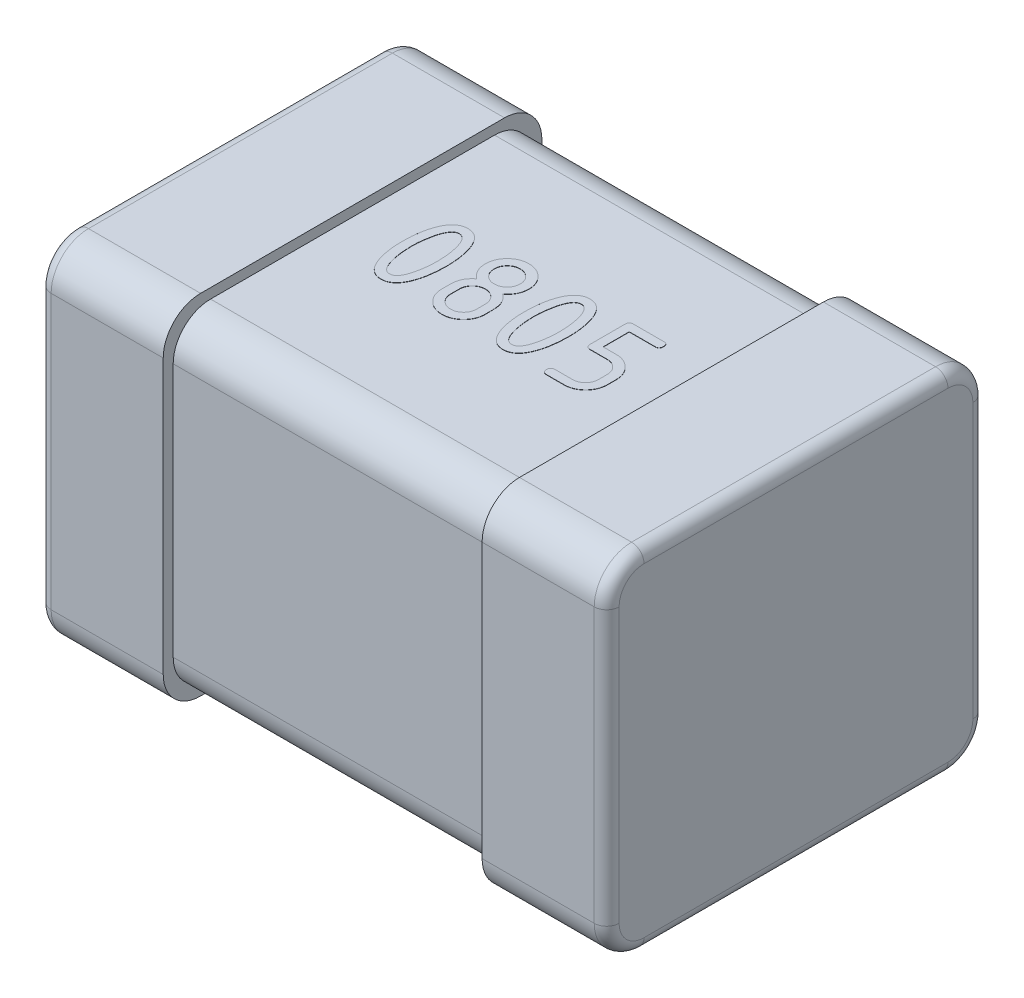
from build123d import *

# Parameters (mm, degrees)
SKETCH1_W               = 2.28
SKETCH1_H               = 1.52
BOSS_EXTRUDE1_DEPTH     = 0.7
CUT_EXTRUDE1_DEPTH      = 0.64
CUT_EXTRUDE1_DEPTH_BACK = 0.64
SKETCH3_OUTSIDE_W       = 4.136
SKETCH3_OUTSIDE_H       = 4.016
SKETCH3_OUTSIDE_W_2     = 1.44
SKETCH3_OUTSIDE_H_2     = 1.32
FILLET1_R               = 0.15
FILLET2_R               = 0.15
FILLET3_R               = 0.05
BOSS_EXTRUDE2_DEPTH     = 0.001


with BuildPart() as part:
    # Sketch1 → Boss-Extrude1 (new, symmetric)
    with BuildSketch(Plane(origin=(0, 0, 0), x_dir=(1, 0, 0), z_dir=(0, 1, 0))):
        Rectangle(SKETCH1_W, SKETCH1_H)
    extrude(amount=BOSS_EXTRUDE1_DEPTH, both=True)

    # Sketch3 outside → Cut-Extrude1 (cut, two sides: drawn at the far end of the back side and taken through both)
    with BuildSketch(Plane(origin=(0, 0, 0), x_dir=(0, 0, -1), z_dir=(1, 0, 0)).offset(-CUT_EXTRUDE1_DEPTH_BACK)):
        Rectangle(SKETCH3_OUTSIDE_W, SKETCH3_OUTSIDE_H)
        Rectangle(SKETCH3_OUTSIDE_W_2, SKETCH3_OUTSIDE_H_2, mode=Mode.SUBTRACT)
    extrude(amount=CUT_EXTRUDE1_DEPTH + CUT_EXTRUDE1_DEPTH_BACK, mode=Mode.SUBTRACT)

    # Fillet1
    fillet1_edges = [part.edges().sort_by_distance(p)[0] for p in [
        (0, -0.66, 0.72),
        (0, -0.66, -0.72),
        (0, 0.66, -0.72),
        (0, 0.66, 0.72),
    ]]
    fillet(fillet1_edges, radius=FILLET1_R)

    # Fillet2
    fillet2_edges = [part.edges().sort_by_distance(p)[0] for p in [
        (-0.89, 0.7, 0.76),
        (0.89, -0.7, 0.76),
        (-0.89, -0.7, -0.76),
        (-0.89, 0.7, -0.76),
        (0.89, 0.7, 0.76),
        (-0.89, -0.7, 0.76),
        (0.89, -0.7, -0.76),
        (0.89, 0.7, -0.76),
    ]]
    fillet(fillet2_edges, radius=FILLET2_R)

    # Fillet3
    fillet3_edges = [part.edges().sort_by_distance(p)[0] for p in [
        (-1.14, 0, 0.76),
        (-1.14, -0.7, 0),
        (-1.14, 0.7, 0),
        (-1.14, 0, -0.76),
        (-1.14, 0.656066017, -0.716066017),
        (-1.14, -0.656066017, -0.716066017),
        (-1.14, 0.656066017, 0.716066017),
        (-1.14, -0.656066017, 0.716066017),
        (1.14, 0.7, 0),
        (1.14, -0.7, 0),
        (1.14, 0, -0.76),
        (1.14, 0, 0.76),
        (1.14, -0.656066017, -0.716066017),
        (1.14, 0.656066017, -0.716066017),
        (1.14, -0.656066017, 0.716066017),
        (1.14, 0.656066017, 0.716066017),
    ]]
    fillet(fillet3_edges, radius=FILLET3_R)

    # Sketch4 → Boss-Extrude2 (add)
    # profile 1 of 4: a face of its own
    with BuildSketch(Plane(origin=(0, 0.66, 0), x_dir=(1, 0, 0), z_dir=(0, 1, 0))):
        with BuildLine():
            add(Edge.make_bspline(
                [(-0.28, 0.015785935), (-0.280046262, 0.010655154), (-0.280137186, 0.000570931), (-0.28081567, -0.014287297), (-0.282122841, -0.028608792), (-0.283681174, -0.042411166), (-0.28590852, -0.055670388), (-0.288563008, -0.068414673), (-0.291623884, -0.080662211), (-0.294151144, -0.088549105), (-0.295390625, -0.09241719)],
                knots=[0, 0, 0, 0, 1.121884543, 2.204992808, 3.251003932, 4.265943523, 5.241379217, 6.189508073, 7.112053941, 8, 8, 8, 8], degree=3))
            add(Edge.make_bspline(
                [(-0.295390625, -0.09241719), (-0.297279595, -0.097674185), (-0.30089121, -0.107725298), (-0.307891066, -0.121359317), (-0.315588453, -0.133031829), (-0.324268521, -0.142575695), (-0.333803325, -0.150071106), (-0.344261611, -0.155437314), (-0.355615923, -0.158674607), (-0.363494625, -0.159032248), (-0.3675, -0.159214065)],
                knots=[0, 0, 0, 0, 1.267950427, 2.424258098, 3.472816797, 4.435939713, 5.342465326, 6.213003319, 7.091526505, 8, 8, 8, 8], degree=3))
            add(Edge.make_bspline(
                [(-0.3675, -0.159214065), (-0.371505069, -0.15903186), (-0.379383168, -0.158673457), (-0.390741875, -0.15544172), (-0.401169271, -0.150061785), (-0.410759823, -0.142663403), (-0.419383348, -0.133113626), (-0.427113498, -0.121523157), (-0.434124701, -0.107940889), (-0.43772318, -0.097909606), (-0.439609375, -0.092651565)],
                knots=[0, 0, 0, 0, 0.910041478, 1.790080955, 2.662121456, 3.566587881, 4.531373102, 5.576831042, 6.729861149, 8, 8, 8, 8], degree=3))
            add(Edge.make_bspline(
                [(-0.439609375, -0.092651565), (-0.44084894, -0.088783494), (-0.443376371, -0.080896627), (-0.446435911, -0.068648874), (-0.449100955, -0.05588029), (-0.451310173, -0.042592052), (-0.452883712, -0.028739686), (-0.454179827, -0.014391032), (-0.454864933, 0.000518743), (-0.454954378, 0.010629079), (-0.455, 0.015785935)],
                knots=[0, 0, 0, 0, 0.886064917, 1.806656342, 2.752776557, 3.731751904, 4.744541313, 5.793997073, 6.874810739, 8, 8, 8, 8], degree=3))
            add(Edge.make_bspline(
                [(-0.455, 0.015785935), (-0.454954378, 0.020942792), (-0.454864933, 0.031053127), (-0.454179827, 0.045962903), (-0.452883712, 0.060311556), (-0.451310173, 0.074163922), (-0.449100955, 0.08745216), (-0.446435911, 0.100220744), (-0.443376371, 0.112468497), (-0.44084894, 0.120355364), (-0.439609375, 0.124223435)],
                knots=[0, 0, 0, 0, 1.125189261, 2.206002927, 3.255458687, 4.268248096, 5.247223443, 6.193343658, 7.113935083, 8, 8, 8, 8], degree=3))
            add(Edge.make_bspline(
                [(-0.439609375, 0.124223435), (-0.43772318, 0.129481476), (-0.434124701, 0.139512759), (-0.427113498, 0.153095028), (-0.419383348, 0.164685496), (-0.410759823, 0.174235273), (-0.401169271, 0.181633655), (-0.390741875, 0.18701359), (-0.379383168, 0.190245328), (-0.371505069, 0.19060373), (-0.3675, 0.190785935)],
                knots=[0, 0, 0, 0, 1.270138851, 2.423168958, 3.468626898, 4.433412119, 5.337878544, 6.209919045, 7.089958522, 8, 8, 8, 8], degree=3))
            add(Edge.make_bspline(
                [(-0.3675, 0.190785935), (-0.363494625, 0.190604118), (-0.355615923, 0.190246477), (-0.344261611, 0.187009184), (-0.333803325, 0.181642976), (-0.324268521, 0.174147565), (-0.315588453, 0.164603699), (-0.307891066, 0.152931187), (-0.30089121, 0.139297168), (-0.297279595, 0.129246055), (-0.295390625, 0.12398906)],
                knots=[0, 0, 0, 0, 0.908473495, 1.786996681, 2.657534674, 3.564060287, 4.527183203, 5.575741902, 6.732049573, 8, 8, 8, 8], degree=3))
            add(Edge.make_bspline(
                [(-0.295390625, 0.12398906), (-0.294151144, 0.120120975), (-0.291623884, 0.112234081), (-0.288563008, 0.099986544), (-0.28590852, 0.087242258), (-0.283681174, 0.073983037), (-0.282122841, 0.060180663), (-0.28081567, 0.045859168), (-0.280137186, 0.031000939), (-0.280046262, 0.020916716), (-0.28, 0.015785935)],
                knots=[0, 0, 0, 0, 0.887946059, 1.810491927, 2.758620783, 3.734056477, 4.748996068, 5.795007192, 6.878115457, 8, 8, 8, 8], degree=3))
        make_face()
        with BuildLine():
            add(Edge.make_bspline(
                [(-0.315, 0.015785935), (-0.315086915, 0.02292592), (-0.315258809, 0.037046971), (-0.317170671, 0.057878257), (-0.319935666, 0.078122758), (-0.322853106, 0.091245127), (-0.324296875, 0.09773906)],
                knots=[0, 0, 0, 0, 1.036187695, 2.04931225, 3.03465332, 4, 4, 4, 4], degree=3))
            add(Edge.make_bspline(
                [(-0.324296875, 0.09773906), (-0.32547645, 0.102291239), (-0.327704022, 0.110887816), (-0.331921362, 0.122732827), (-0.336525222, 0.132821549), (-0.341715569, 0.141081452), (-0.347308174, 0.147688189), (-0.353581898, 0.152350812), (-0.360395422, 0.155221405), (-0.365130273, 0.155597636), (-0.3675, 0.155785935)],
                knots=[0, 0, 0, 0, 1.452784662, 2.743516012, 3.881318599, 4.872714509, 5.751019032, 6.539832634, 7.269206463, 8, 8, 8, 8], degree=3))
            add(Edge.make_bspline(
                [(-0.3675, 0.155785935), (-0.36987367, 0.155607815), (-0.374602219, 0.155252986), (-0.381324249, 0.152247913), (-0.387542115, 0.147612745), (-0.393067788, 0.140963594), (-0.398219201, 0.13267967), (-0.402864053, 0.12255815), (-0.407056582, 0.110650448), (-0.409287629, 0.102004005), (-0.41046875, 0.09742656)],
                knots=[0, 0, 0, 0, 0.73024413, 1.454707756, 2.2364598, 3.108818404, 4.106268943, 5.243216136, 6.540552912, 8, 8, 8, 8], degree=3))
            add(Edge.make_bspline(
                [(-0.41046875, 0.09742656), (-0.411933245, 0.090827865), (-0.414869644, 0.077597087), (-0.417767383, 0.05733777), (-0.419633257, 0.036706645), (-0.419877125, 0.022795265), (-0.42, 0.015785935)],
                knots=[0, 0, 0, 0, 0.984359877, 1.973700231, 2.979037069, 4, 4, 4, 4], degree=3))
            add(Edge.make_bspline(
                [(-0.42, 0.015785935), (-0.419913139, 0.008671989), (-0.419741356, -0.005397071), (-0.417826553, -0.026176238), (-0.415048304, -0.04644329), (-0.412145296, -0.059620801), (-0.410703125, -0.06616719)],
                knots=[0, 0, 0, 0, 1.032445105, 2.041839016, 3.027215061, 4, 4, 4, 4], degree=3))
            add(Edge.make_bspline(
                [(-0.410703125, -0.06616719), (-0.40952355, -0.070719369), (-0.407295978, -0.079315946), (-0.403078638, -0.091160957), (-0.398474778, -0.101249679), (-0.393284431, -0.109509582), (-0.387691826, -0.116116319), (-0.381418102, -0.120778942), (-0.374604578, -0.123649535), (-0.369869727, -0.124025766), (-0.3675, -0.124214065)],
                knots=[0, 0, 0, 0, 1.452784662, 2.743516012, 3.881318599, 4.872714509, 5.751019032, 6.539832634, 7.269206463, 8, 8, 8, 8], degree=3))
            add(Edge.make_bspline(
                [(-0.3675, -0.124214065), (-0.365130273, -0.124025766), (-0.360395422, -0.123649535), (-0.353581898, -0.120778942), (-0.347308174, -0.116116319), (-0.341715569, -0.109509582), (-0.336525222, -0.101249679), (-0.331921362, -0.091160957), (-0.327704022, -0.079315946), (-0.32547645, -0.070719369), (-0.324296875, -0.06616719)],
                knots=[0, 0, 0, 0, 0.730793537, 1.460167366, 2.248980968, 3.127285491, 4.118681401, 5.256483988, 6.547215338, 8, 8, 8, 8], degree=3))
            add(Edge.make_bspline(
                [(-0.324296875, -0.06616719), (-0.322854704, -0.059620801), (-0.319951696, -0.04644329), (-0.317173447, -0.026176238), (-0.315258644, -0.005397071), (-0.315086861, 0.008671989), (-0.315, 0.015785935)],
                knots=[0, 0, 0, 0, 0.972784939, 1.958160984, 2.967554895, 4, 4, 4, 4], degree=3))
        make_face(mode=Mode.SUBTRACT)
    # profile 2 of 4: a face of its own
    with BuildSketch(Plane(origin=(0, 0.66, 0), x_dir=(1, 0, 0), z_dir=(0, 1, 0))):
        with BuildLine():
            add(Edge.make_bspline(
                [(-0.1225, -0.159214065), (-0.125472136, -0.15913874), (-0.131335884, -0.158990131), (-0.139958556, -0.157821305), (-0.14823998, -0.155743262), (-0.15620746, -0.152952851), (-0.16383255, -0.149344606), (-0.171067876, -0.144889506), (-0.17806404, -0.139763055), (-0.184527458, -0.133741522), (-0.19054899, -0.127278105), (-0.195675442, -0.120281941), (-0.200130541, -0.113046615), (-0.203738786, -0.105421525), (-0.206529197, -0.097454045), (-0.20860724, -0.089172621), (-0.209776066, -0.080549949), (-0.209924675, -0.074686201), (-0.21, -0.071714065)],
                knots=[0, 0, 0, 0, 1.035857351, 2.043650141, 3.025599911, 4.00750772, 4.982044535, 5.959747152, 6.965575591, 8, 9.034424409, 10.040252848, 11.017955465, 11.99249228, 12.974400089, 13.956349859, 14.964142649, 16, 16, 16, 16], degree=3))
            Line((-0.21, -0.071714065), (-0.21, -0.036714065))
            add(Edge.make_bspline(
                [(-0.21, -0.036714065), (-0.209898937, -0.033166151), (-0.209700879, -0.026213143), (-0.208027638, -0.016059659), (-0.205249161, -0.006461736), (-0.201559218, 0.002683173), (-0.196508297, 0.011158298), (-0.190565532, 0.019215145), (-0.183412306, 0.026656129), (-0.177991947, 0.031050386), (-0.175234375, 0.033285935)],
                knots=[0, 0, 0, 0, 1.048185513, 2.054176508, 3.031096563, 3.99737623, 4.959754699, 5.938825261, 6.951390663, 8, 8, 8, 8], degree=3))
            add(Edge.make_bspline(
                [(-0.175234375, 0.033285935), (-0.177992304, 0.035521289), (-0.183413363, 0.03991516), (-0.190561527, 0.047358924), (-0.196536105, 0.055423811), (-0.20151604, 0.063936527), (-0.205270522, 0.073050099), (-0.208023572, 0.08263337), (-0.209701958, 0.092784524), (-0.209899301, 0.099737856), (-0.21, 0.103285935)],
                knots=[0, 0, 0, 0, 1.048668505, 2.061291041, 3.040416849, 4.009506313, 4.968732406, 5.945707584, 6.951755342, 8, 8, 8, 8], degree=3))
            add(Edge.make_bspline(
                [(-0.21, 0.103285935), (-0.209924568, 0.106258016), (-0.209775748, 0.112121654), (-0.208608457, 0.120745123), (-0.206524757, 0.129023611), (-0.203763045, 0.136979726), (-0.200081371, 0.144564926), (-0.19572901, 0.151837549), (-0.19051581, 0.158773178), (-0.18453626, 0.165243948), (-0.178036844, 0.171247171), (-0.171094464, 0.176470766), (-0.163829052, 0.180911853), (-0.156208404, 0.184525969), (-0.148239726, 0.187314797), (-0.139958626, 0.189393267), (-0.131335866, 0.190561977), (-0.12547213, 0.190710602), (-0.1225, 0.190785935)],
                knots=[0, 0, 0, 0, 1.036004481, 2.043940414, 3.026029657, 4.008076933, 4.974556657, 5.960164742, 6.958858073, 7.993429408, 9.028000743, 10.039406346, 11.017247833, 11.991923067, 12.973970343, 13.956059586, 14.963995519, 16, 16, 16, 16], degree=3))
            add(Edge.make_bspline(
                [(-0.1225, 0.190785935), (-0.119527926, 0.190710495), (-0.113664299, 0.190561659), (-0.105040742, 0.189394484), (-0.09676258, 0.187310358), (-0.088805259, 0.184550221), (-0.081224519, 0.180862721), (-0.07392139, 0.176524512), (-0.067040175, 0.171214082), (-0.060533143, 0.165252792), (-0.054571853, 0.15874576), (-0.049261423, 0.151864545), (-0.044923215, 0.144561416), (-0.041235714, 0.136980676), (-0.038475577, 0.129023356), (-0.036391451, 0.120745194), (-0.035224276, 0.112121636), (-0.03507544, 0.10625801), (-0.035, 0.103285935)],
                knots=[0, 0, 0, 0, 1.03614655, 2.044220704, 3.026444622, 4.008626568, 4.975238828, 5.960982072, 6.965286792, 8, 9.034713208, 10.039017928, 11.024761172, 11.991373432, 12.973555378, 13.955779296, 14.96385345, 16, 16, 16, 16], degree=3))
            add(Edge.make_bspline(
                [(-0.035, 0.103285935), (-0.035090583, 0.099735923), (-0.035268212, 0.092774519), (-0.037091044, 0.082646492), (-0.039765807, 0.07301273), (-0.043740982, 0.063936284), (-0.048846127, 0.055389488), (-0.055080754, 0.04738338), (-0.062374638, 0.039885117), (-0.067940807, 0.03551568), (-0.07078125, 0.033285935)],
                knots=[0, 0, 0, 0, 1.040763239, 2.040887161, 3.010889577, 3.969260993, 4.939173083, 5.925181052, 6.941209693, 8, 8, 8, 8], degree=3))
            add(Edge.make_bspline(
                [(-0.07078125, 0.033285935), (-0.068698536, 0.031676366), (-0.064617748, 0.028522641), (-0.059027911, 0.023340946), (-0.054114549, 0.017835114), (-0.049679318, 0.012136831), (-0.045928082, 0.006066789), (-0.04272141, -0.000249383), (-0.040098311, -0.006834805), (-0.038887542, -0.011387453), (-0.03828125, -0.01366719)],
                knots=[0, 0, 0, 0, 1.082926845, 2.121843868, 3.131151544, 4.117203343, 5.089648923, 6.062625877, 7.029860409, 8, 8, 8, 8], degree=3))
            add(Edge.make_bspline(
                [(-0.03828125, -0.01366719), (-0.038000116, -0.014991942), (-0.037375451, -0.01793547), (-0.03685005, -0.02288418), (-0.036166483, -0.028732632), (-0.035733788, -0.035537581), (-0.035445872, -0.04324879), (-0.035209684, -0.051895286), (-0.035057498, -0.061479183), (-0.035019751, -0.068198381), (-0.035, -0.071714065)],
                knots=[0, 0, 0, 0, 0.557891606, 1.239604717, 2.04926997, 2.985402085, 4.048998662, 5.230248263, 6.550783673, 8, 8, 8, 8], degree=3))
            add(Edge.make_bspline(
                [(-0.035, -0.071714065), (-0.035075333, -0.074686195), (-0.035223958, -0.08054993), (-0.036392668, -0.089172691), (-0.038471138, -0.097453791), (-0.041259966, -0.105422469), (-0.044874082, -0.113043116), (-0.04931517, -0.120308529), (-0.054538764, -0.127250909), (-0.060541987, -0.133750325), (-0.067012757, -0.139729875), (-0.073948387, -0.144943075), (-0.081221009, -0.149295436), (-0.088806209, -0.15297711), (-0.096762324, -0.155738822), (-0.105040812, -0.157822522), (-0.113664281, -0.158989813), (-0.119527919, -0.159138633), (-0.1225, -0.159214065)],
                knots=[0, 0, 0, 0, 1.036004481, 2.043940414, 3.026029657, 4.008076933, 4.982752167, 5.960593654, 6.971999257, 8.006570592, 9.041141927, 10.039835258, 11.025443343, 11.991923067, 12.973970343, 13.956059586, 14.963995519, 16, 16, 16, 16], degree=3))
        make_face()
        with BuildLine():
            add(Edge.make_bspline(
                [(-0.1225, -0.124214065), (-0.118935592, -0.124055651), (-0.111992817, -0.123747091), (-0.102059176, -0.120682049), (-0.092994649, -0.115850877), (-0.08500851, -0.109205555), (-0.078363187, -0.101219416), (-0.073532016, -0.092154889), (-0.070466974, -0.082221248), (-0.070158414, -0.075278472), (-0.07, -0.071714065)],
                knots=[0, 0, 0, 0, 1.032801548, 2.011697431, 2.989774545, 4, 5.010225455, 5.988302569, 6.967198452, 8, 8, 8, 8], degree=3))
            Line((-0.07, -0.071714065), (-0.07, -0.036714065))
            add(Edge.make_bspline(
                [(-0.07, -0.036714065), (-0.070165934, -0.03320398), (-0.07049147, -0.026317752), (-0.073494722, -0.01642103), (-0.07849983, -0.007421655), (-0.085153764, 0.000632171), (-0.09320759, 0.007286105), (-0.102206965, 0.012291213), (-0.112103687, 0.015294465), (-0.118989915, 0.015620001), (-0.1225, 0.015785935)],
                knots=[0, 0, 0, 0, 1.01963496, 2.000361676, 2.977215234, 4, 5.022784766, 5.999638324, 6.98036504, 8, 8, 8, 8], degree=3))
            add(Edge.make_bspline(
                [(-0.1225, 0.015785935), (-0.126064408, 0.015627521), (-0.133007183, 0.015318961), (-0.142940824, 0.012253919), (-0.152005351, 0.007422748), (-0.15999149, 0.000777426), (-0.166636813, -0.007208714), (-0.171467984, -0.016273241), (-0.174533026, -0.026206881), (-0.174841586, -0.033149657), (-0.175, -0.036714065)],
                knots=[0, 0, 0, 0, 1.032801548, 2.011697431, 2.989774545, 4, 5.010225455, 5.988302569, 6.967198452, 8, 8, 8, 8], degree=3))
            Line((-0.175, -0.036714065), (-0.175, -0.071714065))
            add(Edge.make_bspline(
                [(-0.175, -0.071714065), (-0.174841586, -0.075278472), (-0.174533026, -0.082221248), (-0.171467984, -0.092154889), (-0.166636813, -0.101219416), (-0.15999149, -0.109205555), (-0.152005351, -0.115850877), (-0.142940824, -0.120682049), (-0.133007183, -0.123747091), (-0.126064408, -0.124055651), (-0.1225, -0.124214065)],
                knots=[0, 0, 0, 0, 1.032801548, 2.011697431, 2.989774545, 4, 5.010225455, 5.988302569, 6.967198452, 8, 8, 8, 8], degree=3))
        make_face(mode=Mode.SUBTRACT)
        with BuildLine():
            add(Edge.make_bspline(
                [(-0.1225, 0.050785935), (-0.118935592, 0.050944349), (-0.111992817, 0.051252909), (-0.102059176, 0.054317951), (-0.092994649, 0.059149123), (-0.08500851, 0.065794445), (-0.078363187, 0.073780584), (-0.073532016, 0.082845111), (-0.070466974, 0.092778752), (-0.070158414, 0.099721528), (-0.07, 0.103285935)],
                knots=[0, 0, 0, 0, 1.032801548, 2.011697431, 2.989774545, 4, 5.010225455, 5.988302569, 6.967198452, 8, 8, 8, 8], degree=3))
            add(Edge.make_bspline(
                [(-0.07, 0.103285935), (-0.070165934, 0.10679602), (-0.07049147, 0.113682248), (-0.073494722, 0.12357897), (-0.07849983, 0.132578345), (-0.085153764, 0.140632171), (-0.09320759, 0.147286105), (-0.102206965, 0.152291213), (-0.112103687, 0.155294465), (-0.118989915, 0.155620001), (-0.1225, 0.155785935)],
                knots=[0, 0, 0, 0, 1.01963496, 2.000361676, 2.977215234, 4, 5.022784766, 5.999638324, 6.98036504, 8, 8, 8, 8], degree=3))
            add(Edge.make_bspline(
                [(-0.1225, 0.155785935), (-0.126064408, 0.155627521), (-0.133007183, 0.155318961), (-0.142940824, 0.152253919), (-0.152005351, 0.147422748), (-0.15999149, 0.140777426), (-0.166636813, 0.132791286), (-0.171467984, 0.123726759), (-0.174533026, 0.113793119), (-0.174841586, 0.106850343), (-0.175, 0.103285935)],
                knots=[0, 0, 0, 0, 1.032801548, 2.011697431, 2.989774545, 4, 5.010225455, 5.988302569, 6.967198452, 8, 8, 8, 8], degree=3))
            add(Edge.make_bspline(
                [(-0.175, 0.103285935), (-0.174841586, 0.099721528), (-0.174533026, 0.092778752), (-0.171467984, 0.082845111), (-0.166636813, 0.073780584), (-0.15999149, 0.065794445), (-0.152005351, 0.059149123), (-0.142940824, 0.054317951), (-0.133007183, 0.051252909), (-0.126064408, 0.050944349), (-0.1225, 0.050785935)],
                knots=[0, 0, 0, 0, 1.032801548, 2.011697431, 2.989774545, 4, 5.010225455, 5.988302569, 6.967198452, 8, 8, 8, 8], degree=3))
        make_face(mode=Mode.SUBTRACT)
    # profile 3 of 4: a face of its own
    with BuildSketch(Plane(origin=(0, 0.66, 0), x_dir=(1, 0, 0), z_dir=(0, 1, 0))):
        with BuildLine():
            add(Edge.make_bspline(
                [(0.21, 0.015785935), (0.209953738, 0.010655154), (0.209862814, 0.000570931), (0.20918433, -0.014287297), (0.207877159, -0.028608792), (0.206318826, -0.042411166), (0.20409148, -0.055670388), (0.201436992, -0.068414673), (0.198376116, -0.080662211), (0.195848856, -0.088549105), (0.194609375, -0.09241719)],
                knots=[0, 0, 0, 0, 1.121884543, 2.204992808, 3.251003932, 4.265943523, 5.241379217, 6.189508073, 7.112053941, 8, 8, 8, 8], degree=3))
            add(Edge.make_bspline(
                [(0.194609375, -0.09241719), (0.192720405, -0.097674185), (0.18910879, -0.107725298), (0.182108934, -0.121359317), (0.174411547, -0.133031829), (0.165731479, -0.142575695), (0.156196675, -0.150071106), (0.145738389, -0.155437314), (0.134384077, -0.158674607), (0.126505375, -0.159032248), (0.1225, -0.159214065)],
                knots=[0, 0, 0, 0, 1.267950427, 2.424258098, 3.472816797, 4.435939713, 5.342465326, 6.213003319, 7.091526505, 8, 8, 8, 8], degree=3))
            add(Edge.make_bspline(
                [(0.1225, -0.159214065), (0.118494931, -0.15903186), (0.110616832, -0.158673457), (0.099258125, -0.15544172), (0.088830729, -0.150061785), (0.079240177, -0.142663403), (0.070616652, -0.133113626), (0.062886502, -0.121523157), (0.055875299, -0.107940889), (0.05227682, -0.097909606), (0.050390625, -0.092651565)],
                knots=[0, 0, 0, 0, 0.910041478, 1.790080955, 2.662121456, 3.566587881, 4.531373102, 5.576831042, 6.729861149, 8, 8, 8, 8], degree=3))
            add(Edge.make_bspline(
                [(0.050390625, -0.092651565), (0.04915106, -0.088783494), (0.046623629, -0.080896627), (0.043564089, -0.068648874), (0.040899045, -0.05588029), (0.038689827, -0.042592052), (0.037116288, -0.028739686), (0.035820173, -0.014391032), (0.035135067, 0.000518743), (0.035045622, 0.010629079), (0.035, 0.015785935)],
                knots=[0, 0, 0, 0, 0.886064917, 1.806656342, 2.752776557, 3.731751904, 4.744541313, 5.793997073, 6.874810739, 8, 8, 8, 8], degree=3))
            add(Edge.make_bspline(
                [(0.035, 0.015785935), (0.035045622, 0.020942792), (0.035135067, 0.031053127), (0.035820173, 0.045962903), (0.037116288, 0.060311556), (0.038689827, 0.074163922), (0.040899045, 0.08745216), (0.043564089, 0.100220744), (0.046623629, 0.112468497), (0.04915106, 0.120355364), (0.050390625, 0.124223435)],
                knots=[0, 0, 0, 0, 1.125189261, 2.206002927, 3.255458687, 4.268248096, 5.247223443, 6.193343658, 7.113935083, 8, 8, 8, 8], degree=3))
            add(Edge.make_bspline(
                [(0.050390625, 0.124223435), (0.05227682, 0.129481476), (0.055875299, 0.139512759), (0.062886502, 0.153095028), (0.070616652, 0.164685496), (0.079240177, 0.174235273), (0.088830729, 0.181633655), (0.099258125, 0.18701359), (0.110616832, 0.190245328), (0.118494931, 0.19060373), (0.1225, 0.190785935)],
                knots=[0, 0, 0, 0, 1.270138851, 2.423168958, 3.468626898, 4.433412119, 5.337878544, 6.209919045, 7.089958522, 8, 8, 8, 8], degree=3))
            add(Edge.make_bspline(
                [(0.1225, 0.190785935), (0.126505375, 0.190604118), (0.134384077, 0.190246477), (0.145738389, 0.187009184), (0.156196675, 0.181642976), (0.165731479, 0.174147565), (0.174411547, 0.164603699), (0.182108934, 0.152931187), (0.18910879, 0.139297168), (0.192720405, 0.129246055), (0.194609375, 0.12398906)],
                knots=[0, 0, 0, 0, 0.908473495, 1.786996681, 2.657534674, 3.564060287, 4.527183203, 5.575741902, 6.732049573, 8, 8, 8, 8], degree=3))
            add(Edge.make_bspline(
                [(0.194609375, 0.12398906), (0.195848856, 0.120120975), (0.198376116, 0.112234081), (0.201436992, 0.099986544), (0.20409148, 0.087242258), (0.206318826, 0.073983037), (0.207877159, 0.060180663), (0.20918433, 0.045859168), (0.209862814, 0.031000939), (0.209953738, 0.020916716), (0.21, 0.015785935)],
                knots=[0, 0, 0, 0, 0.887946059, 1.810491927, 2.758620783, 3.734056477, 4.748996068, 5.795007192, 6.878115457, 8, 8, 8, 8], degree=3))
        make_face()
        with BuildLine():
            add(Edge.make_bspline(
                [(0.175, 0.015785935), (0.174913085, 0.02292592), (0.174741191, 0.037046971), (0.172829329, 0.057878257), (0.170064334, 0.078122758), (0.167146894, 0.091245127), (0.165703125, 0.09773906)],
                knots=[0, 0, 0, 0, 1.036187695, 2.04931225, 3.03465332, 4, 4, 4, 4], degree=3))
            add(Edge.make_bspline(
                [(0.165703125, 0.09773906), (0.16452355, 0.102291239), (0.162295978, 0.110887816), (0.158078638, 0.122732827), (0.153474778, 0.132821549), (0.148284431, 0.141081452), (0.142691826, 0.147688189), (0.136418102, 0.152350812), (0.129604578, 0.155221405), (0.124869727, 0.155597636), (0.1225, 0.155785935)],
                knots=[0, 0, 0, 0, 1.452784662, 2.743516012, 3.881318599, 4.872714509, 5.751019032, 6.539832634, 7.269206463, 8, 8, 8, 8], degree=3))
            add(Edge.make_bspline(
                [(0.1225, 0.155785935), (0.12012633, 0.155607815), (0.115397781, 0.155252986), (0.108675751, 0.152247913), (0.102457885, 0.147612745), (0.096932212, 0.140963594), (0.091780799, 0.13267967), (0.087135947, 0.12255815), (0.082943418, 0.110650448), (0.080712371, 0.102004005), (0.07953125, 0.09742656)],
                knots=[0, 0, 0, 0, 0.73024413, 1.454707756, 2.2364598, 3.108818404, 4.106268943, 5.243216136, 6.540552912, 8, 8, 8, 8], degree=3))
            add(Edge.make_bspline(
                [(0.07953125, 0.09742656), (0.078066755, 0.090827865), (0.075130356, 0.077597087), (0.072232617, 0.05733777), (0.070366743, 0.036706645), (0.070122875, 0.022795265), (0.07, 0.015785935)],
                knots=[0, 0, 0, 0, 0.984359877, 1.973700231, 2.979037069, 4, 4, 4, 4], degree=3))
            add(Edge.make_bspline(
                [(0.07, 0.015785935), (0.070086861, 0.008671989), (0.070258644, -0.005397071), (0.072173447, -0.026176238), (0.074951696, -0.04644329), (0.077854704, -0.059620801), (0.079296875, -0.06616719)],
                knots=[0, 0, 0, 0, 1.032445105, 2.041839016, 3.027215061, 4, 4, 4, 4], degree=3))
            add(Edge.make_bspline(
                [(0.079296875, -0.06616719), (0.08047645, -0.070719369), (0.082704022, -0.079315946), (0.086921362, -0.091160957), (0.091525222, -0.101249679), (0.096715569, -0.109509582), (0.102308174, -0.116116319), (0.108581898, -0.120778942), (0.115395422, -0.123649535), (0.120130273, -0.124025766), (0.1225, -0.124214065)],
                knots=[0, 0, 0, 0, 1.452784662, 2.743516012, 3.881318599, 4.872714509, 5.751019032, 6.539832634, 7.269206463, 8, 8, 8, 8], degree=3))
            add(Edge.make_bspline(
                [(0.1225, -0.124214065), (0.124869727, -0.124025766), (0.129604578, -0.123649535), (0.136418102, -0.120778942), (0.142691826, -0.116116319), (0.148284431, -0.109509582), (0.153474778, -0.101249679), (0.158078638, -0.091160957), (0.162295978, -0.079315946), (0.16452355, -0.070719369), (0.165703125, -0.06616719)],
                knots=[0, 0, 0, 0, 0.730793537, 1.460167366, 2.248980968, 3.127285491, 4.118681401, 5.256483988, 6.547215338, 8, 8, 8, 8], degree=3))
            add(Edge.make_bspline(
                [(0.165703125, -0.06616719), (0.167145296, -0.059620801), (0.170048304, -0.04644329), (0.172826553, -0.026176238), (0.174741356, -0.005397071), (0.174913139, 0.008671989), (0.175, 0.015785935)],
                knots=[0, 0, 0, 0, 0.972784939, 1.958160984, 2.967554895, 4, 4, 4, 4], degree=3))
        make_face(mode=Mode.SUBTRACT)
    # profile 4 of 4: a face of its own
    with BuildSketch(Plane(origin=(0, 0.66, 0), x_dir=(1, 0, 0), z_dir=(0, 1, 0))):
        with BuildLine():
            Line((0.28, 0.033285935), (0.28, 0.173285935))
            add(Edge.make_bspline(
                [(0.28, 0.173285935), (0.280065524, 0.174669504), (0.280187876, 0.177253046), (0.280942348, 0.180904338), (0.282346911, 0.183967029), (0.28430382, 0.18652967), (0.286829555, 0.188500632), (0.289954403, 0.189827767), (0.293544807, 0.19071162), (0.296139914, 0.19076038), (0.2975, 0.190785935)],
                knots=[0, 0, 0, 0, 1.171278472, 2.187130384, 3.133692503, 3.997641031, 4.892513739, 5.809895742, 6.852174597, 8, 8, 8, 8], degree=3))
            Line((0.2975, 0.190785935), (0.42, 0.190785935))
            add(Edge.make_bspline(
                [(0.42, 0.190785935), (0.421179789, 0.190763136), (0.423419602, 0.190719853), (0.426507816, 0.189800212), (0.429220104, 0.188496066), (0.431338691, 0.186460553), (0.433060028, 0.183948962), (0.434173958, 0.180859469), (0.4348977, 0.177251779), (0.434964287, 0.174670422), (0.435, 0.173285935)],
                knots=[0, 0, 0, 0, 1.068261721, 2.028079452, 2.907358655, 3.778947221, 4.665850375, 5.655597643, 6.742602228, 8, 8, 8, 8], degree=3))
            add(Edge.make_bspline(
                [(0.435, 0.173285935), (0.434958262, 0.171929166), (0.434878965, 0.169351453), (0.434210236, 0.165749386), (0.433009119, 0.162681072), (0.43139726, 0.160107489), (0.42916457, 0.158183867), (0.426550069, 0.156721233), (0.423396737, 0.155984087), (0.421174858, 0.155854472), (0.42, 0.155785935)],
                knots=[0, 0, 0, 0, 1.235590019, 2.347486928, 3.316607166, 4.224570492, 5.081519046, 5.97322276, 6.928305512, 8, 8, 8, 8], degree=3))
            Line((0.42, 0.155785935), (0.315, 0.155785935))
            Line((0.315, 0.155785935), (0.315, 0.050785935))
            Line((0.315, 0.050785935), (0.3675, 0.050785935))
            add(Edge.make_bspline(
                [(0.3675, 0.050785935), (0.37047386, 0.050721769), (0.376344644, 0.050595098), (0.38494001, 0.049265625), (0.393247818, 0.047336303), (0.401214658, 0.044560526), (0.40875478, 0.040769073), (0.416081307, 0.036452037), (0.422960257, 0.031135221), (0.429462163, 0.025171618), (0.435460309, 0.018665101), (0.440684496, 0.011724313), (0.445128053, 0.004459414), (0.448721297, -0.003142556), (0.451544568, -0.011072879), (0.45360469, -0.019334509), (0.454773083, -0.027930228), (0.454923892, -0.033767952), (0.455, -0.036714065)],
                knots=[0, 0, 0, 0, 1.036592186, 2.046367411, 3.026869952, 4.009474324, 4.98046233, 5.966629532, 6.971366193, 8.00652442, 9.041682647, 10.053662, 11.032058197, 12.007286346, 12.981329115, 13.963975477, 14.972483193, 16, 16, 16, 16], degree=3))
            Line((0.455, -0.036714065), (0.455, -0.071714065))
            add(Edge.make_bspline(
                [(0.455, -0.071714065), (0.454935942, -0.074687981), (0.454809483, -0.080558878), (0.453478465, -0.089153429), (0.451554822, -0.097464229), (0.448750204, -0.10544212), (0.445032595, -0.11302281), (0.44061235, -0.120311194), (0.435382376, -0.127251362), (0.42937688, -0.133745628), (0.422906371, -0.139762146), (0.41591179, -0.144889172), (0.408676979, -0.149346743), (0.401070574, -0.152934126), (0.393141438, -0.155758967), (0.384879487, -0.157818663), (0.376283855, -0.158987172), (0.370446119, -0.159137965), (0.3675, -0.159214065)],
                knots=[0, 0, 0, 0, 1.03644959, 2.046085907, 3.026453569, 4.008922771, 4.987943079, 5.966204685, 6.978044827, 8.013060656, 9.048076484, 10.054479993, 11.032741599, 12.007835593, 12.981744371, 13.964255558, 14.972624541, 16, 16, 16, 16], degree=3))
            Line((0.3675, -0.159214065), (0.2975, -0.159214065))
            add(Edge.make_bspline(
                [(0.2975, -0.159214065), (0.296144414, -0.159142213), (0.293565262, -0.159005506), (0.289915144, -0.158311237), (0.286882737, -0.156813526), (0.284245008, -0.154969057), (0.282400539, -0.152331327), (0.280902828, -0.149298921), (0.280208559, -0.145648803), (0.280071852, -0.143069651), (0.28, -0.141714065)],
                knots=[0, 0, 0, 0, 1.150813752, 2.189550435, 3.117366144, 4, 4.882633856, 5.810449565, 6.849186248, 8, 8, 8, 8], degree=3))
            add(Edge.make_bspline(
                [(0.28, -0.141714065), (0.280018585, -0.140325848), (0.280053388, -0.137726191), (0.280997556, -0.134134284), (0.282232164, -0.130980224), (0.284314269, -0.1285269), (0.286750677, -0.126470565), (0.289882412, -0.12517872), (0.293464876, -0.124286471), (0.296061168, -0.124238963), (0.297421875, -0.124214065)],
                knots=[0, 0, 0, 0, 1.171153265, 2.193170214, 3.131774486, 4.010381834, 4.888989181, 5.807411693, 6.850872717, 8, 8, 8, 8], degree=3))
            Line((0.297421875, -0.124214065), (0.36703125, -0.124214065))
            add(Edge.make_bspline(
                [(0.36703125, -0.124214065), (0.370568965, -0.124052563), (0.377484393, -0.123736865), (0.387375748, -0.120698199), (0.396385921, -0.115848941), (0.404293867, -0.109180346), (0.410928869, -0.101219938), (0.415786797, -0.092168414), (0.41872683, -0.08220652), (0.419051756, -0.075275975), (0.41921875, -0.071714065)],
                knots=[0, 0, 0, 0, 1.028113879, 2.00972855, 2.983840323, 3.991032407, 5.004063664, 5.984857292, 6.964329947, 8, 8, 8, 8], degree=3))
            Line((0.41921875, -0.071714065), (0.41921875, -0.036714065))
            add(Edge.make_bspline(
                [(0.41921875, -0.036714065), (0.419054748, -0.033202895), (0.418733002, -0.026314539), (0.415705881, -0.016445318), (0.410815259, -0.007396394), (0.404140172, 0.000602912), (0.396174663, 0.007284961), (0.387227838, 0.012307326), (0.377373622, 0.015284282), (0.370514686, 0.015616972), (0.36703125, 0.015785935)],
                knots=[0, 0, 0, 0, 1.022656678, 2.006289806, 2.982404609, 4.008220429, 5.028189808, 6.001281017, 6.984914145, 8, 8, 8, 8], degree=3))
            Line((0.36703125, 0.015785935), (0.297421875, 0.015785935))
            add(Edge.make_bspline(
                [(0.297421875, 0.015785935), (0.296065682, 0.015857138), (0.293485376, 0.01599261), (0.289842996, 0.016695156), (0.286804032, 0.018156645), (0.284255175, 0.020087228), (0.282285606, 0.022616193), (0.280958074, 0.02574012), (0.280074343, 0.029330806), (0.280025565, 0.031925871), (0.28, 0.033285935)],
                knots=[0, 0, 0, 0, 1.152245291, 2.192274096, 3.121243949, 3.987402553, 4.884564444, 5.804293213, 6.849238333, 8, 8, 8, 8], degree=3))
        make_face()
    extrude(amount=BOSS_EXTRUDE2_DEPTH)


solid = part.part
